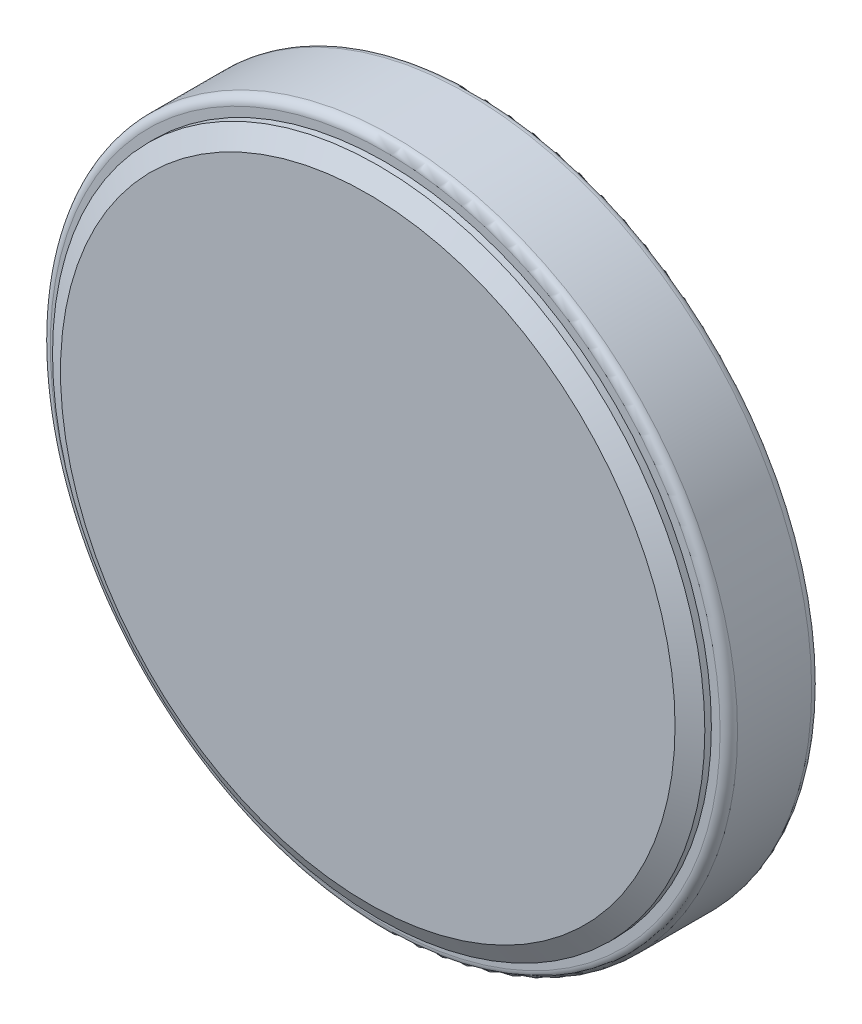
from build123d import *

# Parameters (mm, degrees)
SKETCH1_R           = 10.0076
BASE_EXTRUDE_DEPTH  = 2.667
FILLET1_R           = 0.254
FILLET2_R           = 0.254
SKETCH2_R           = 9.4996
BOSS_EXTRUDE2_DEPTH = 0.508
CHAMFER3_SIZE       = 0.3175
CHAMFER3_SIZE2      = 0.549926131
CUT_EXTRUDE1_DEPTH  = 0.254


with BuildPart() as part:
    # Sketch1 → Base-Extrude (new body)
    with BuildSketch(Plane.XY):
        Circle(SKETCH1_R)
    extrude(amount=-BASE_EXTRUDE_DEPTH)

    # Fillet1
    fillet1_edges = [part.edges().sort_by_distance(p)[0] for p in [
        (-10.0076, 0, -2.667),
    ]]
    fillet(fillet1_edges, radius=FILLET1_R)

    # Fillet2
    fillet2_edges = [part.edges().sort_by_distance(p)[0] for p in [
        (-10.0076, 0, 0),
    ]]
    fillet(fillet2_edges, radius=FILLET2_R)

    # Sketch2 → Boss-Extrude2 (add)
    with BuildSketch(Plane.XY):
        Circle(SKETCH2_R)
    extrude(amount=BOSS_EXTRUDE2_DEPTH)

    # Chamfer3
    chamfer3_edges = [part.edges().sort_by_distance(p)[0] for p in [
        (-9.4996, 0, 0.508),
    ]]
    chamfer3_side = [part.faces().sort_by_distance(p)[0] for p in [
        (-9.4996, 0, 0.254),
    ]]
    chamfer(chamfer3_edges, length=CHAMFER3_SIZE, length2=CHAMFER3_SIZE2, reference=chamfer3_side[0])

    # Sketch3 → Cut-Extrude1 (cut)
    with BuildSketch(Plane(origin=(0, 0, -2.667), x_dir=(-1, 0, 0), z_dir=(0, 0, -1))):
        Polygon((-0.254, 2.54), (0.254, 2.54), (0.254, 0.254), (2.54, 0.254), (2.54, -0.254), (0.254, -0.254), (0.254, -2.54), (-0.254, -2.54), (-0.254, -0.254), (-2.54, -0.254), (-2.54, 0.254), (-0.254, 0.254), align=None)
    extrude(amount=-CUT_EXTRUDE1_DEPTH, mode=Mode.SUBTRACT)


solid = part.part
